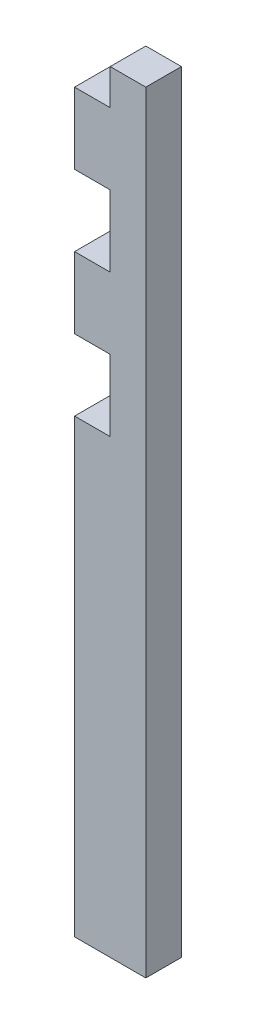
from build123d import *

# Parameters (mm, degrees)
SKETCH1_W           = 12
SKETCH1_H           = 100
BOSS_EXTRUDE4_DEPTH = 6
SKETCH1_8_W         = 12
SKETCH1_8_H         = 30
BOSS_EXTRUDE5_DEPTH = 6
CUT_EXTRUDE1_REACH  = 102.896
SKETCH4_W           = 6
SKETCH4_H           = 12


with BuildPart() as part:
    # Sketch1 → Boss-Extrude4 (new body)
    with BuildSketch(Plane.XY):
        with Locations((6, 50)):
            Rectangle(SKETCH1_W, SKETCH1_H)
    extrude(amount=BOSS_EXTRUDE4_DEPTH)

    # Sketch1<8> → Boss-Extrude5 (add)
    with BuildSketch(Plane.XY):
        with Locations((6, -15)):
            Rectangle(SKETCH1_8_W, SKETCH1_8_H)
    extrude(amount=BOSS_EXTRUDE5_DEPTH)

    # Sketch4 → Cut-Extrude1 (cut, up to next)
    with BuildSketch(Plane(origin=(0, 0, 0), x_dir=(-1, 0, 0), z_dir=(0, 0, -1)), mode=Mode.PRIVATE) as cut_extrude1_sk1:
        with Locations((-3, 100)):
            Rectangle(SKETCH4_W, SKETCH4_H)
    cut_extrude1_tool1 = extrude(cut_extrude1_sk1.sketch, amount=-CUT_EXTRUDE1_REACH, mode=Mode.PRIVATE) & part.part
    # Sketch4 → Cut-Extrude1 (cut, up to next)
    with BuildSketch(Plane(origin=(0, 0, 0), x_dir=(-1, 0, 0), z_dir=(0, 0, -1)), mode=Mode.PRIVATE) as cut_extrude1_sk2:
        with Locations((-3, 76)):
            Rectangle(SKETCH4_W, SKETCH4_H)
    cut_extrude1_tool2 = extrude(cut_extrude1_sk2.sketch, amount=-CUT_EXTRUDE1_REACH, mode=Mode.PRIVATE) & part.part
    # Sketch4 → Cut-Extrude1 (cut, up to next)
    with BuildSketch(Plane(origin=(0, 0, 0), x_dir=(-1, 0, 0), z_dir=(0, 0, -1)), mode=Mode.PRIVATE) as cut_extrude1_sk3:
        with Locations((-3, 52)):
            Rectangle(SKETCH4_W, SKETCH4_H)
    cut_extrude1_tool3 = extrude(cut_extrude1_sk3.sketch, amount=-CUT_EXTRUDE1_REACH, mode=Mode.PRIVATE) & part.part
    add(cut_extrude1_tool1.solids().sort_by_distance((3, 100, 0))[0], mode=Mode.SUBTRACT)
    add(cut_extrude1_tool2.solids().sort_by_distance((3, 76, 0))[0], mode=Mode.SUBTRACT)
    add(cut_extrude1_tool3.solids().sort_by_distance((3, 52, 0))[0], mode=Mode.SUBTRACT)


solid = part.part
